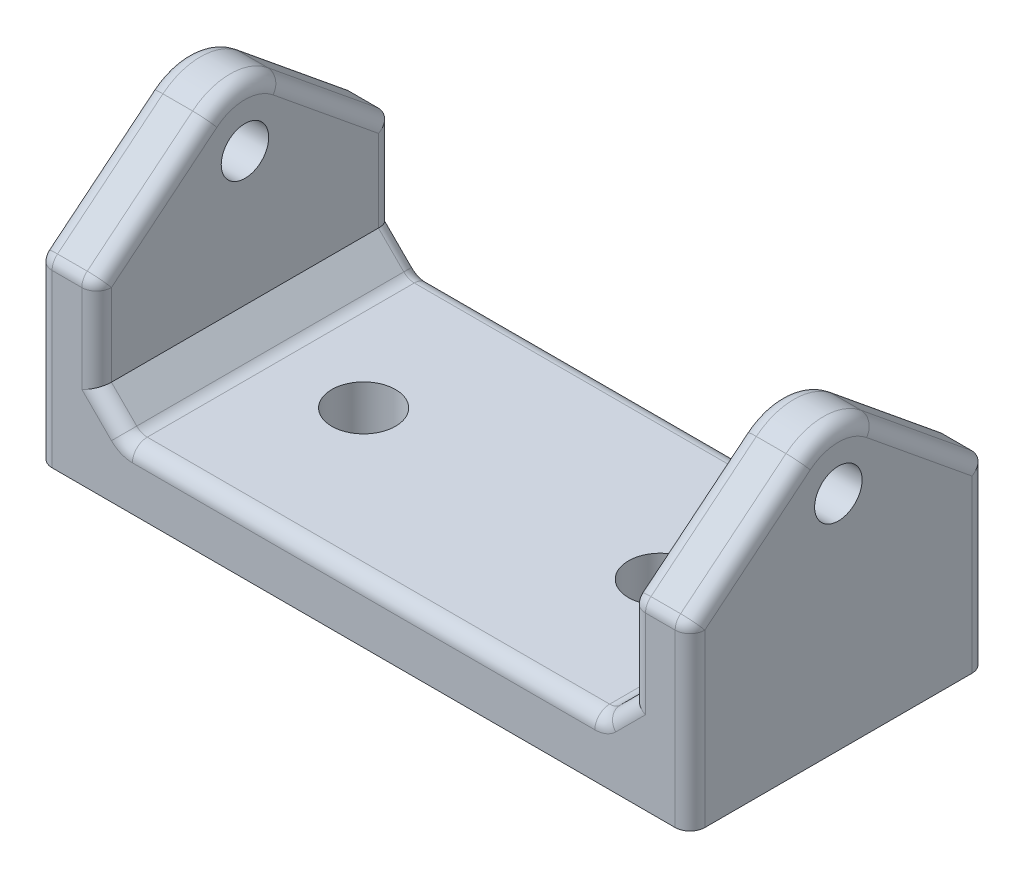
from build123d import *

# Parameters (mm, degrees)
SKETCH1_W           = 20
SKETCH1_H           = 12
SKETCH1_R           = 1.6
BOSS_EXTRUDE1_DEPTH = 44
SKETCH2_W           = 36
SKETCH2_H           = 15
CUT_EXTRUDE1_DEPTH  = 51.049975025
CHAMFER1_SIZE       = 2
FILLET1_R           = 1
SKETCH3_R           = 2.15
CUT_EXTRUDE2_DEPTH  = 48.549973712


with BuildPart() as part:
    # Sketch1 → Boss-Extrude1 (new body)
    # profile 1 of 2: a face of its own
    with BuildSketch(Plane(origin=(0, 0, 0), x_dir=(0, 0, -1), z_dir=(1, 0, 0))):
        Rectangle(SKETCH1_W, SKETCH1_H)
    # profile 2 of 2: a face of its own
    with BuildSketch(Plane(origin=(0, 0, 0), x_dir=(0, 0, -1), z_dir=(1, 0, 0))):
        with BuildLine():
            ThreePointArc((-2.529576231, 12.098587435), (0, 13), (2.529576231, 12.098587435))
            Line((2.529576231, 12.098587435), (10, 6))
            Line((10, 6), (-10, 6))
            Line((-10, 6), (-2.529576231, 12.098587435))
        make_face()
        with Locations((0, 9)):
            Circle(SKETCH1_R, mode=Mode.SUBTRACT)
    extrude(amount=BOSS_EXTRUDE1_DEPTH)

    # Sketch2 → Cut-Extrude1 (cut, through all)
    with BuildSketch(Plane.XY.offset(10)):
        with Locations((22, 5.5)):
            Rectangle(SKETCH2_W, SKETCH2_H)
    extrude(amount=-CUT_EXTRUDE1_DEPTH, mode=Mode.SUBTRACT)

    # Chamfer1
    chamfer1_edges = [part.edges().sort_by_distance(p)[0] for p in [
        (4, -2, 0),
        (40, -2, 0),
    ]]
    chamfer(chamfer1_edges, length=CHAMFER1_SIZE)

    # Fillet1
    fillet1_edges = [part.edges().sort_by_distance(p)[0] for p in [
        (0, 9.049293718, -6.264788115),
        (0, 0, -10),
        (44, 9.049293718, -6.264788115),
        (42, 6, 10),
        (44, 13, 0),
        (44, 9.049293718, 6.264788115),
        (2, 6, 10),
        (44, 0, 10),
        (4, 9.049293718, -6.264788115),
        (4, 3, -10),
        (4, 13, 0),
        (4, 9.049293718, 6.264788115),
        (40, 9.049293718, -6.264788115),
        (40, 9.049293718, 6.264788115),
        (40, 13, 0),
        (4, 3, 10),
        (40, 3, -10),
        (40, 3, 10),
        (22, -2, 10),
        (22, -2, -10),
        (6, -2, 0),
        (38, -2, 0),
        (39, -1, 10),
        (39, -1, -10),
        (5, -1, 10),
        (5, -1, -10),
        (0, 0, 10),
        (44, 0, -10),
        (0, 9.049293718, 6.264788115),
        (0, 13, 0),
    ]]
    fillet(fillet1_edges, radius=FILLET1_R)

    # Sketch3 → Cut-Extrude2 (cut, through all)
    with BuildSketch(Plane(origin=(0, -2, 0), x_dir=(1, 0, 0), z_dir=(0, 1, 0))):
        with Locations(Location((12, 0, 0), (0, 0, 270))):
            Circle(SKETCH3_R)
        with Locations(Location((32, 0, 0), (0, 0, 270))):
            Circle(SKETCH3_R)
    extrude(amount=-CUT_EXTRUDE2_DEPTH, mode=Mode.SUBTRACT)


solid = part.part
